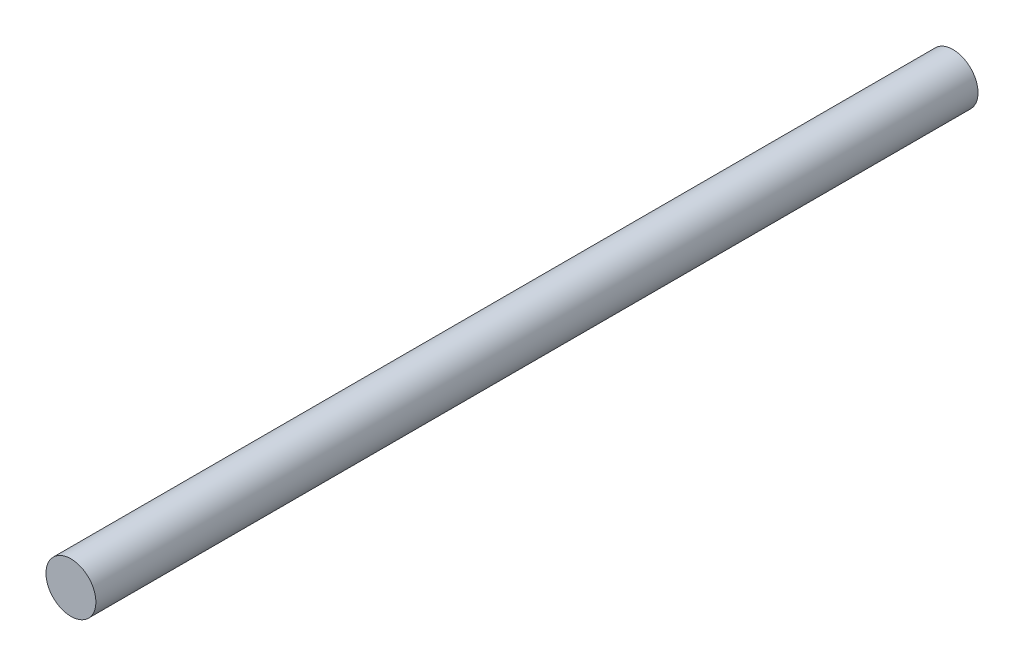
from build123d import *

# Parameters (mm, degrees)
SKETCH1_R           = 3
BOSS_EXTRUDE1_DEPTH = 106


with BuildPart() as part:
    # Sketch1 → Boss-Extrude1 (new body)
    with BuildSketch(Plane.XY):
        Circle(SKETCH1_R)
    extrude(amount=BOSS_EXTRUDE1_DEPTH)


solid = part.part
